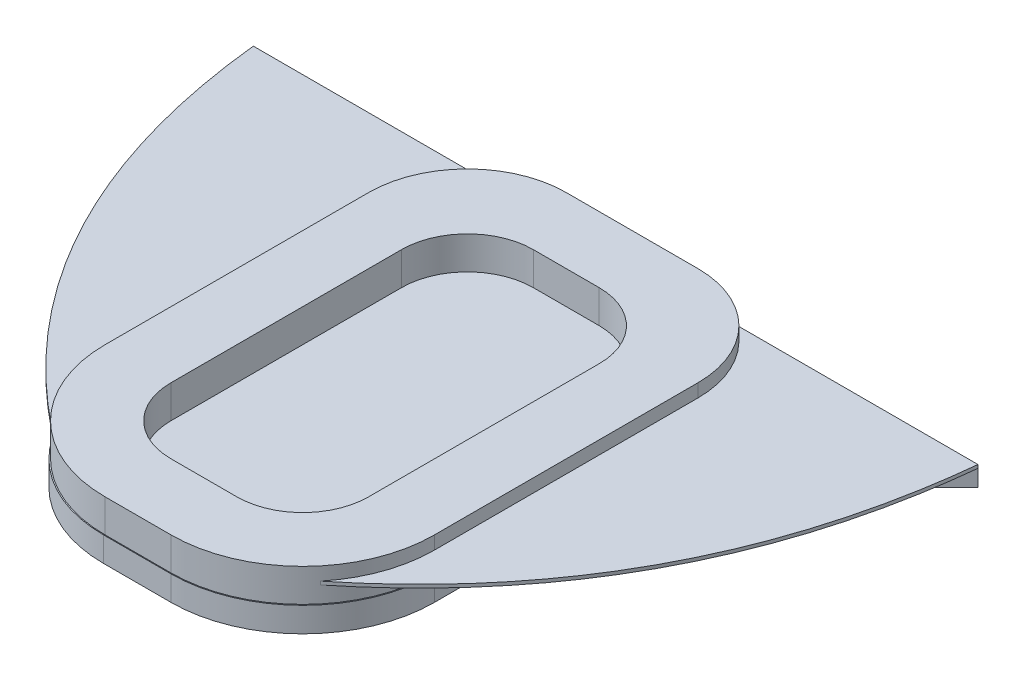
from build123d import *

# Parameters (mm, degrees)
EXTRUDE_1_DEPTH = 1.5
SKETCH_2_W      = 2
SKETCH_2_H      = 22
EXTRUDE_2_DEPTH = 1
EXTRUDE_3_DEPTH = 0.2
EXTRUDE_4_DEPTH = 2


with BuildPart() as part:
    # 草图1 → 凸台-拉伸1 (new body)
    with BuildSketch(Plane(origin=(0, 0, 0), x_dir=(1, 0, 0), z_dir=(0, 1, 0))):
        with BuildLine():
            Line((-4.05, 15.05), (4.05, 15.05))
            ThreePointArc((4.05, 15.05), (8.292640687, 13.292640687), (10.05, 9.05))
            Line((10.05, 9.05), (10.05, -7.05))
            ThreePointArc((10.05, -7.05), (7.706854249, -12.706854249), (2.05, -15.05))
            Line((2.05, -15.05), (-2.05, -15.05))
            ThreePointArc((-2.05, -15.05), (-7.706854249, -12.706854249), (-10.05, -7.05))
            Line((-10.05, -7.05), (-10.05, 9.05))
            ThreePointArc((-10.05, 9.05), (-8.292640687, 13.292640687), (-4.05, 15.05))
        make_face()
    extrude(amount=EXTRUDE_1_DEPTH)

    # 草图2 → 凸台-拉伸2 (add)
    with BuildSketch(Plane(origin=(0, 1.5, 0), x_dir=(1, 0, 0), z_dir=(0, 1, 0))):
        with Locations((-8, 1)):
            Rectangle(SKETCH_2_W, SKETCH_2_H)
        with BuildLine():
            Line((-9, 12), (-7, 12))
            Line((-7, 12), (-2, 12))
            Line((-2, 12), (-2, 14))
            Line((-2, 14), (-7.440796367, 14))
            ThreePointArc((-7.440796367, 14), (-8.472295614, 13.105034094), (-9.274700948, 12))
            Line((-9.274700948, 12), (-9, 12))
        make_face()
        with BuildLine():
            Line((-20, 12), (-9.274700948, 12))
            ThreePointArc((-9.274700948, 12), (-8.472295614, 13.105034094), (-7.440796367, 14))
            Line((-7.440796367, 14), (-20, 14))
            Line((-20, 14), (-20, 12))
        make_face()
        Polygon((-20, 14), (-22, 14), (-20, 12), align=None)
        Polygon((-7, -13), (-9, -10), (-7, -10), align=None)
        with BuildLine():
            ThreePointArc((9.274700948, 12), (8.472295614, 13.105034094), (7.440796367, 14))
            Line((7.440796367, 14), (2, 14))
            Line((2, 14), (2, 12))
            Line((2, 12), (7, 12))
            Line((7, 12), (9, 12))
            Line((9, 12), (9.274700948, 12))
        make_face()
        with BuildLine():
            Line((20, 12), (20, 14))
            Line((20, 14), (7.440796367, 14))
            ThreePointArc((7.440796367, 14), (8.472295614, 13.105034094), (9.274700948, 12))
            Line((9.274700948, 12), (20, 12))
        make_face()
        Polygon((20, 12), (20, 14), (22, 14), align=None)
        with Locations((8, 1)):
            Rectangle(SKETCH_2_W, SKETCH_2_H)
        Polygon((7, -10), (9, -10), (7, -13), align=None)
    extrude(amount=EXTRUDE_2_DEPTH)

    # 草图3 → 凸台-拉伸3 (add)
    with BuildSketch(Plane(origin=(0, 2.5, 0), x_dir=(1, 0, 0), z_dir=(0, 1, 0))):
        with BuildLine():
            Line((-7, -13), (-7, 14))
            Line((-7, 14), (-22, 14))
            add(Edge.make_bspline(
                [(-22, 14), (-20.203305703, -3.149159716), (-7, -13)],
                knots=[0, 0, 0, 1, 1, 1], degree=2))
        make_face()
        with BuildLine():
            Line((7, -13), (7, 14))
            Line((7, 14), (22, 14))
            add(Edge.make_bspline(
                [(22, 14), (20.203305703, -3.149159716), (7, -13)],
                knots=[0, 0, 0, 1, 1, 1], degree=2))
        make_face()
    extrude(amount=EXTRUDE_3_DEPTH)

    # 草图4 → 凸台-拉伸4 (add)
    with BuildSketch(Plane(origin=(0, 1.5, 0), x_dir=(1, 0, 0), z_dir=(0, 1, 0))):
        with BuildLine():
            Line((-4, 15), (4, 15))
            ThreePointArc((4, 15), (8.242640687, 13.242640687), (10, 9))
            Line((10, 9), (10, -7))
            ThreePointArc((10, -7), (7.656854249, -12.656854249), (2, -15))
            Line((2, -15), (-2, -15))
            ThreePointArc((-2, -15), (-7.656854249, -12.656854249), (-10, -7))
            Line((-10, -7), (-10, 9))
            ThreePointArc((-10, 9), (-8.242640687, 13.242640687), (-4, 15))
        make_face()
        with BuildLine():
            Line((-2, 11), (2, 11))
            ThreePointArc((2, 11), (4.828427125, 9.828427125), (6, 7))
            Line((6, 7), (6, -7))
            ThreePointArc((6, -7), (4.828427125, -9.828427125), (2, -11))
            Line((2, -11), (-2, -11))
            ThreePointArc((-2, -11), (-4.828427125, -9.828427125), (-6, -7))
            Line((-6, -7), (-6, 7))
            ThreePointArc((-6, 7), (-4.828427125, 9.828427125), (-2, 11))
        make_face(mode=Mode.SUBTRACT)
    extrude(amount=EXTRUDE_4_DEPTH)


solid = part.part
